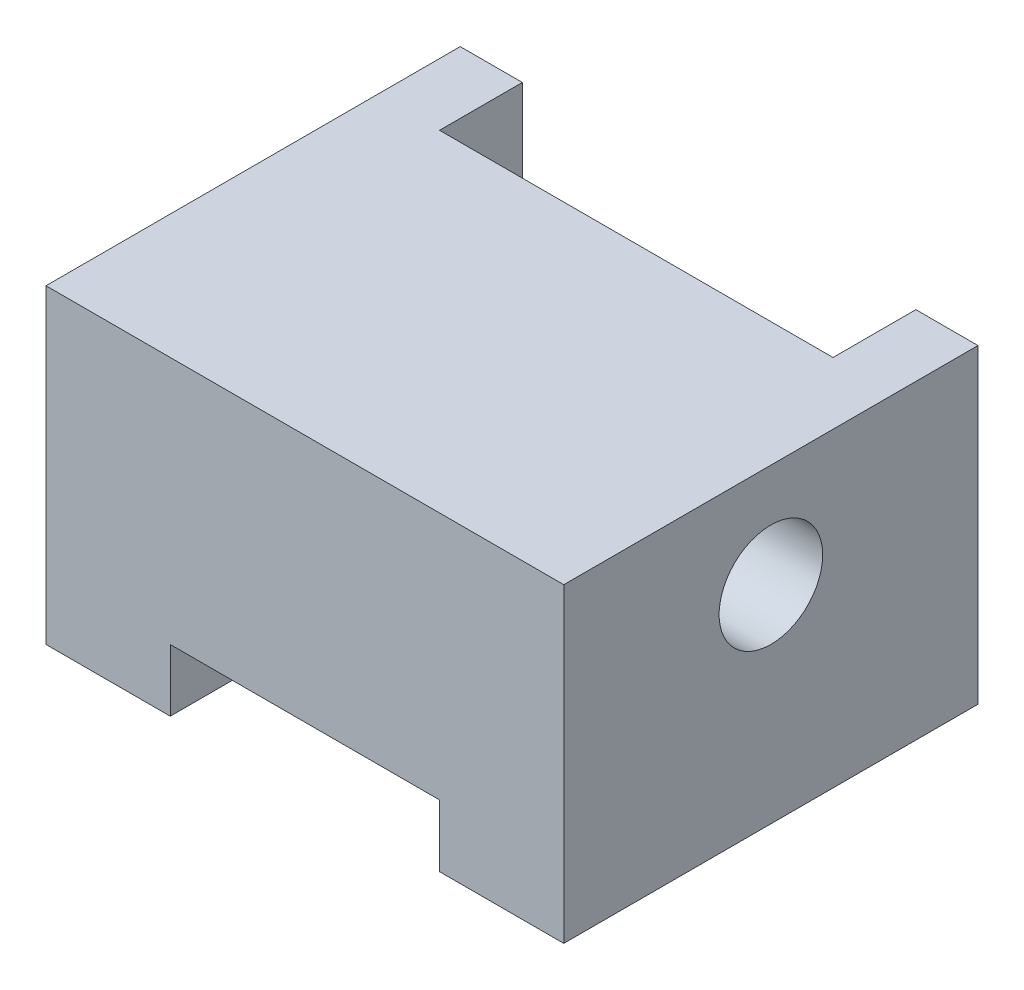
from build123d import *

# Parameters (mm, degrees)
SKETCH_1_W               = 50
SKETCH_1_H               = 30
EXTRUDE_1_DEPTH          = 20
CUT_EXTRUDE_2_DEPTH      = 36.355339059
CUT_EXTRUDE_2_DEPTH_BACK = 36.355339059
SKETCH_2_W               = 26
SKETCH_2_H               = 6
SKETCH_4_W               = 38
SKETCH_4_H               = 8
CUT_EXTRUDE_3_DEPTH      = 44.874821937
SKETCH_5_R               = 5
CUT_EXTRUDE_5_DEPTH      = 27


with BuildPart() as part:
    # 草圖1 → 填料-伸長1 (new, symmetric)
    with BuildSketch(Plane.XY):
        Rectangle(SKETCH_1_W, SKETCH_1_H)
    extrude(amount=EXTRUDE_1_DEPTH, both=True)

    # 草圖2 → 除料-伸長2 (cut, two sides: drawn at the far end of the back side and taken through both)
    with BuildSketch(Plane.XY.offset(-CUT_EXTRUDE_2_DEPTH_BACK)):
        with Locations((0, -12)):
            Rectangle(SKETCH_2_W, SKETCH_2_H)
    extrude(amount=CUT_EXTRUDE_2_DEPTH + CUT_EXTRUDE_2_DEPTH_BACK, mode=Mode.SUBTRACT)

    # 草圖4 → 除料-伸長3 (cut, through all)
    with BuildSketch(Plane(origin=(0, 15, 0), x_dir=(1, 0, 0), z_dir=(0, 1, 0))):
        with Locations((0, 16)):
            Rectangle(SKETCH_4_W, SKETCH_4_H)
    extrude(amount=-CUT_EXTRUDE_3_DEPTH, mode=Mode.SUBTRACT)

    # 草圖5 → 除料-伸長5 (cut)
    with BuildSketch(Plane(origin=(25, 0, 0), x_dir=(0, 0, -1), z_dir=(1, 0, 0))):
        with Locations((0, 5)):
            Circle(SKETCH_5_R)
    extrude(amount=-CUT_EXTRUDE_5_DEPTH, mode=Mode.SUBTRACT)


solid = part.part
